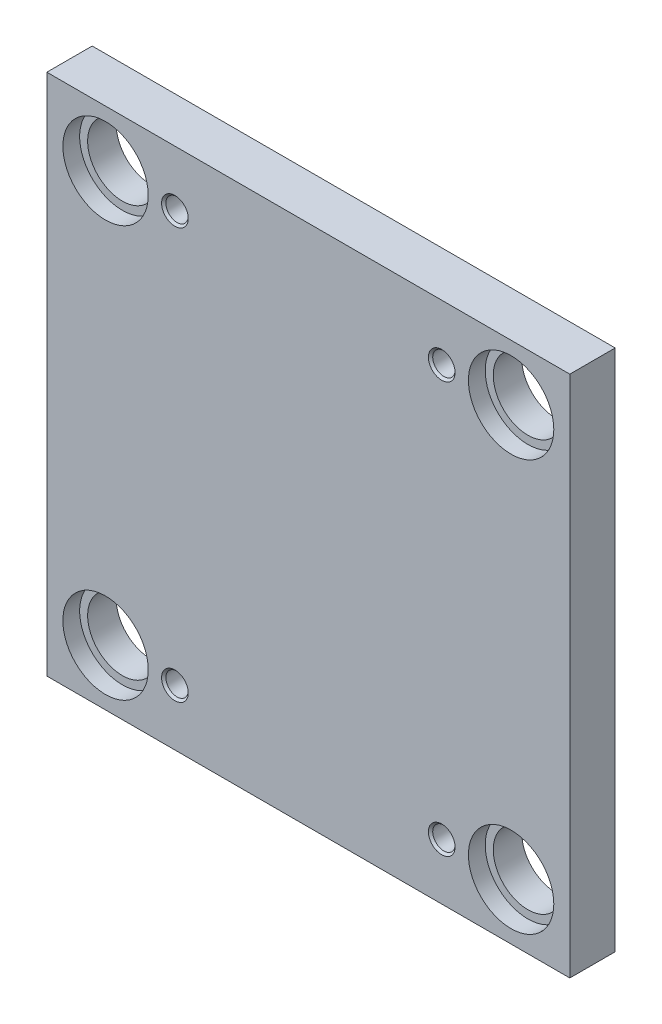
from build123d import *

# Parameters (mm, degrees)
SKETCH_1_W                   = 196
SKETCH_1_H                   = 196
EXTRUDE_1_DEPTH              = 17
HOLE_WIZARD_1_D              = 8.376
HOLE_WIZARD_M241_D           = 26
HOLE_WIZARD_M241_CBORE_D     = 32
HOLE_WIZARD_M241_CBORE_DEPTH = 6.3
CHAMFER_1_SIZE               = 0.812


with BuildPart() as part:
    # Эскиз1 → Бобышка-Вытянуть1 (new body)
    with BuildSketch(Plane.XY.offset(17)):
        Rectangle(SKETCH_1_W, SKETCH_1_H)
    extrude(amount=-EXTRUDE_1_DEPTH)

    # Отверстие1 (through all)
    with Locations(Plane.XY.offset(17)):
        with Locations((-50, 77), (-50, -77), (50, 77), (50, -77)):
            Hole(HOLE_WIZARD_1_D / 2)

    # Цековка для  болта с шестигранной головкой M241 (through all)
    with Locations(Plane.XY.offset(17)):
        with Locations((76, -77), (-76, -77), (76, 77), (-76, 77)):
            CounterBoreHole(HOLE_WIZARD_M241_D / 2, HOLE_WIZARD_M241_CBORE_D / 2, HOLE_WIZARD_M241_CBORE_DEPTH)

    # Фаска1
    chamfer_1_edges = [part.edges().sort_by_distance(p)[0] for p in [
        (54.188, -77, 17),
        (54.188, 77, 17),
        (-45.812, -77, 17),
        (-45.812, 77, 17),
    ]]
    chamfer(chamfer_1_edges, length=CHAMFER_1_SIZE)


solid = part.part
